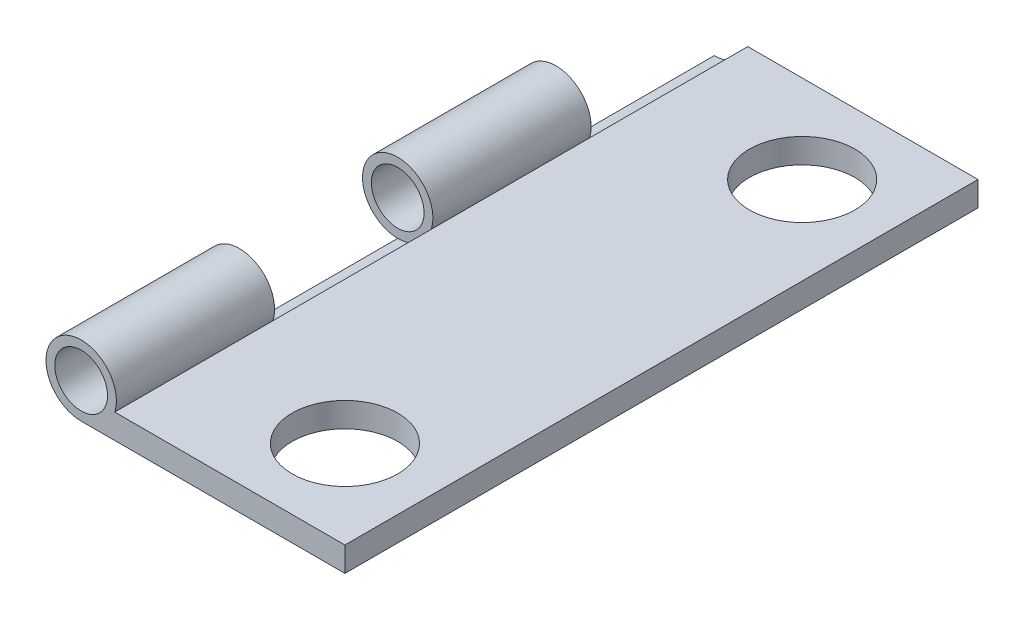
from build123d import *

# Parameters (mm, degrees)
SKETCH1_W           = 7.5
SKETCH1_H           = 18
BOSS_EXTRUDE1_DEPTH = 0.7
SKETCH2_R           = 1
BOSS_EXTRUDE2_DEPTH = 18
SKETCH4_R           = 0.75
CUT_EXTRUDE1_DEPTH  = 20.602295784
CUT_EXTRUDE2_START  = -4.5
SKETCH5_R           = 1
CUT_EXTRUDE2_DEPTH  = 4.5
LPATTERN1_COUNT     = 2
LPATTERN1_PITCH     = 9
SKETCH6_R           = 1.5
CUT_EXTRUDE3_DEPTH  = 20.543285292


with BuildPart() as part:
    # Sketch1 → Boss-Extrude1 (new body)
    with BuildSketch(Plane(origin=(0, 0, 0), x_dir=(1, 0, 0), z_dir=(0, 1, 0))):
        with Locations((3.75, 9)):
            Rectangle(SKETCH1_W, SKETCH1_H)
    extrude(amount=BOSS_EXTRUDE1_DEPTH)

    # Sketch2 → Boss-Extrude2 (add, through all)
    with BuildSketch(Plane.XY):
        with Locations((0, 1)):
            Circle(SKETCH2_R)
    extrude(amount=-BOSS_EXTRUDE2_DEPTH)

    # Sketch4 → Cut-Extrude1 (cut, through all)
    with BuildSketch(Plane.XY):
        with Locations((0, 1)):
            Circle(SKETCH4_R)
    extrude(amount=-CUT_EXTRUDE1_DEPTH, mode=Mode.SUBTRACT)

    # Sketch5 → Cut-Extrude2 (cut)
    with BuildSketch(Plane.XY.offset(CUT_EXTRUDE2_START)):
        with Locations((0, 1)):
            Circle(SKETCH5_R)
    cut_extrude2 = extrude(amount=-CUT_EXTRUDE2_DEPTH, mode=Mode.SUBTRACT)

    # LPattern1: Cut-Extrude2 ×2
    with Locations(*[(0, 0, -i * LPATTERN1_PITCH) for i in range(1, LPATTERN1_COUNT)]):
        add(cut_extrude2, mode=Mode.SUBTRACT)

    # Sketch6 → Cut-Extrude3 (cut, through all)
    with BuildSketch(Plane(origin=(0, 0.7, 0), x_dir=(1, 0, 0), z_dir=(0, 1, 0))):
        with Locations(Location((5, 2.5, 0), (0, 0, 270))):
            Circle(SKETCH6_R)
        with Locations(Location((5, 15.5, 0), (0, 0, 90))):
            Circle(SKETCH6_R)
    extrude(amount=-CUT_EXTRUDE3_DEPTH, mode=Mode.SUBTRACT)


solid = part.part
